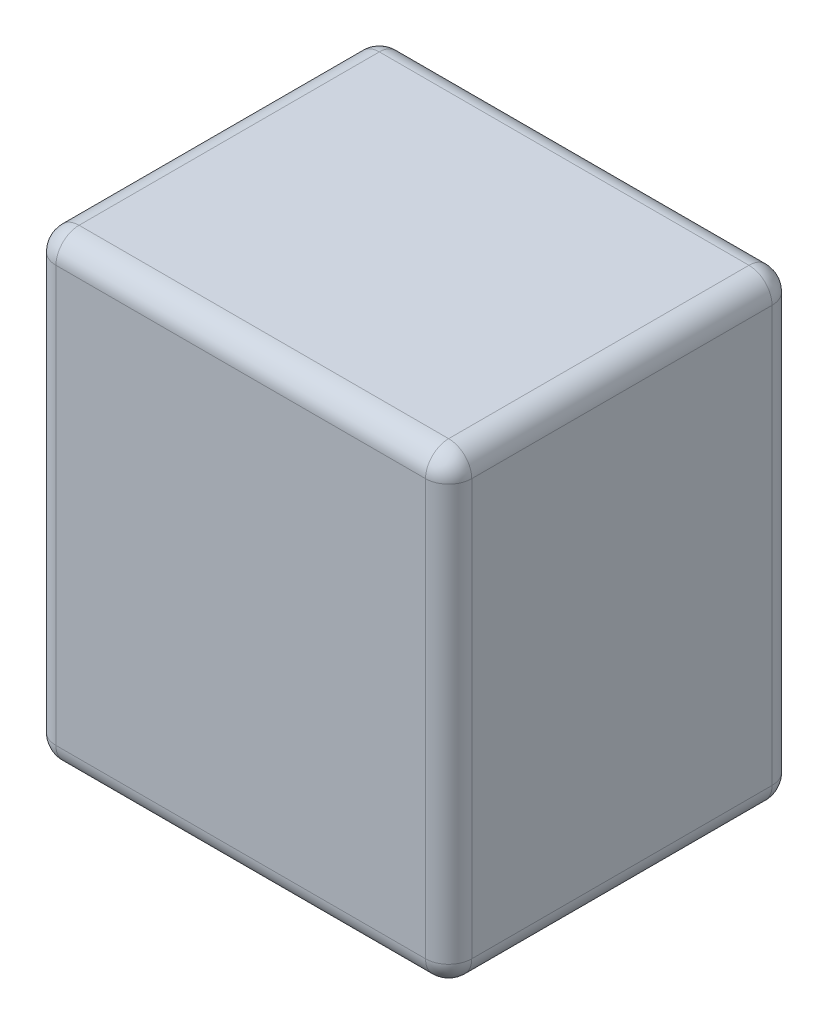
from build123d import *

# Parameters (mm, degrees)
SKETCH1_W           = 45.72
SKETCH1_H           = 50.8
BOSS_EXTRUDE1_DEPTH = 38.1
FILLET1_R           = 2.54


with BuildPart() as part:
    # Sketch1 → Boss-Extrude1 (new body)
    with BuildSketch(Plane.XY):
        Rectangle(SKETCH1_W, SKETCH1_H)
    extrude(amount=BOSS_EXTRUDE1_DEPTH)

    # Fillet1
    fillet1_edges = [part.edges().sort_by_distance(p)[0] for p in [
        (-22.86, 0, 38.1),
        (0, -25.4, 38.1),
        (22.86, 0, 38.1),
        (0, -25.4, 0),
        (-22.86, 0, 0),
        (0, 25.4, 0),
        (22.86, 0, 0),
        (22.86, -25.4, 19.05),
        (-22.86, -25.4, 19.05),
        (-22.86, 25.4, 19.05),
        (22.86, 25.4, 19.05),
        (0, 25.4, 38.1),
    ]]
    fillet(fillet1_edges, radius=FILLET1_R)


solid = part.part
